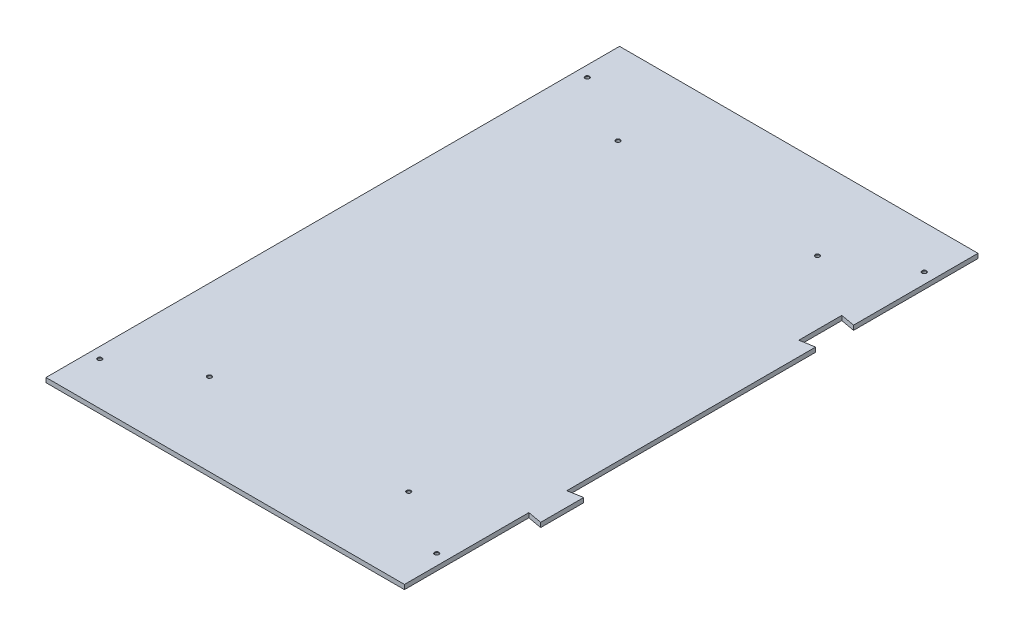
from build123d import *

# Parameters (mm, degrees)
BOSS_EXTRUDE1_DEPTH             = 3.175
M3X0_5_TAPPED_HOLE1_D           = 2.5
M3X0_5_TAPPED_HOLE1_CSINK_D     = 3.05
M3X0_5_TAPPED_HOLE1_CSINK_ANGLE = 90


with BuildPart() as part:
    # Sketch1 → Boss-Extrude1 (new body)
    with BuildSketch(Plane(origin=(0, 0, 0), x_dir=(1, 0, 0), z_dir=(0, 1, 0))):
        Polygon((0, 86.763269807), (-10, 85), (-10, 115), (0, 113.236730193), (0, 200), (-250, 200), (-250, -200), (0, -200), (0, -113.236730193), (10, -115), (10, -85), (0, -86.763269807), align=None)
    extrude(amount=BOSS_EXTRUDE1_DEPTH)

    # M3x0.5 Tapped Hole1 (through all)
    with Locations(Plane(origin=(0, 3.175, 0), x_dir=(1, 0, 0), z_dir=(0, 1, 0))):
        with Locations((-193.539921074, 142.5), (-193.539921074, -142.5), (-54.516495305, 142.5), (-54.516495305, -142.5), (-242.5, -170), (-242.5, 170), (-7.5, -170), (-7.5, 170)):
            CounterSinkHole(M3X0_5_TAPPED_HOLE1_D / 2, M3X0_5_TAPPED_HOLE1_CSINK_D / 2, counter_sink_angle=M3X0_5_TAPPED_HOLE1_CSINK_ANGLE)


solid = part.part
